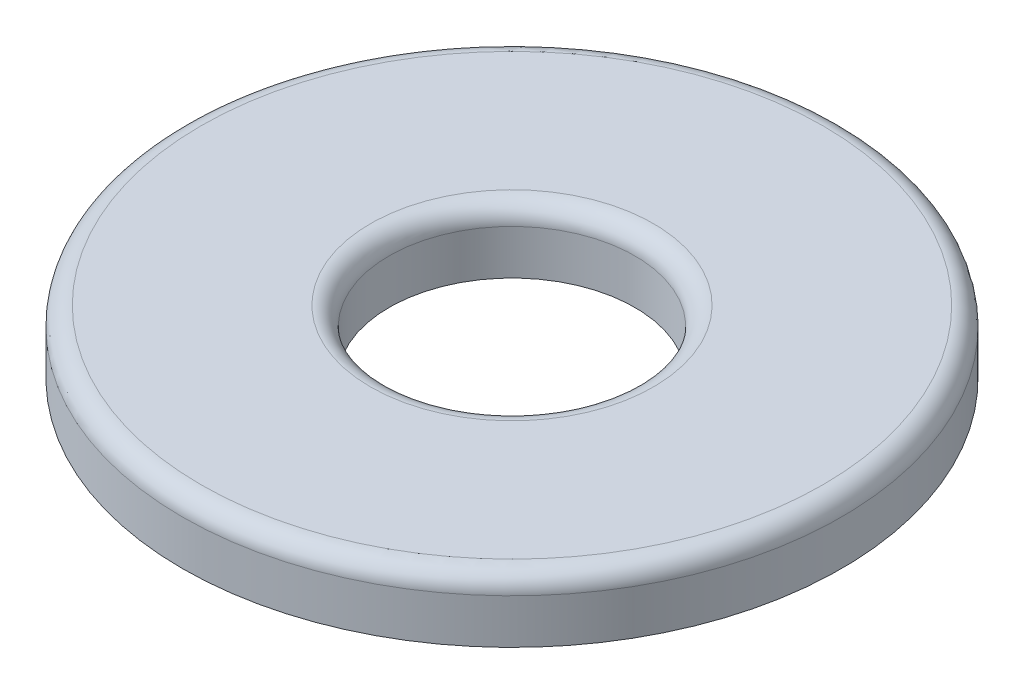
from build123d import *


with BuildPart() as part:
    # Sketch1 → Revolve1 (revolve)
    with BuildSketch(Plane(origin=(0, 0, 0), x_dir=(0, 0, -1), z_dir=(1, 0, 0)), mode=Mode.PRIVATE) as revolve1_sk:
        with BuildLine():
            Line((1.65, 0), (4.425, 0))
            Line((4.425, 0), (4.425, 0.6))
            ThreePointArc((4.425, 0.6), (4.351776695, 0.776776695), (4.175, 0.85))
            Line((4.175, 0.85), (1.9, 0.85))
            ThreePointArc((1.9, 0.85), (1.723223305, 0.776776695), (1.65, 0.6))
            Line((1.65, 0.6), (1.65, 0))
        make_face()
    revolve(revolve1_sk.sketch.rotate(Axis((0, 2.184529438, 0), (0, -1, 0)), 180), axis=Axis((0, 2.184529438, 0), (0, -1, 0)))


solid = part.part
